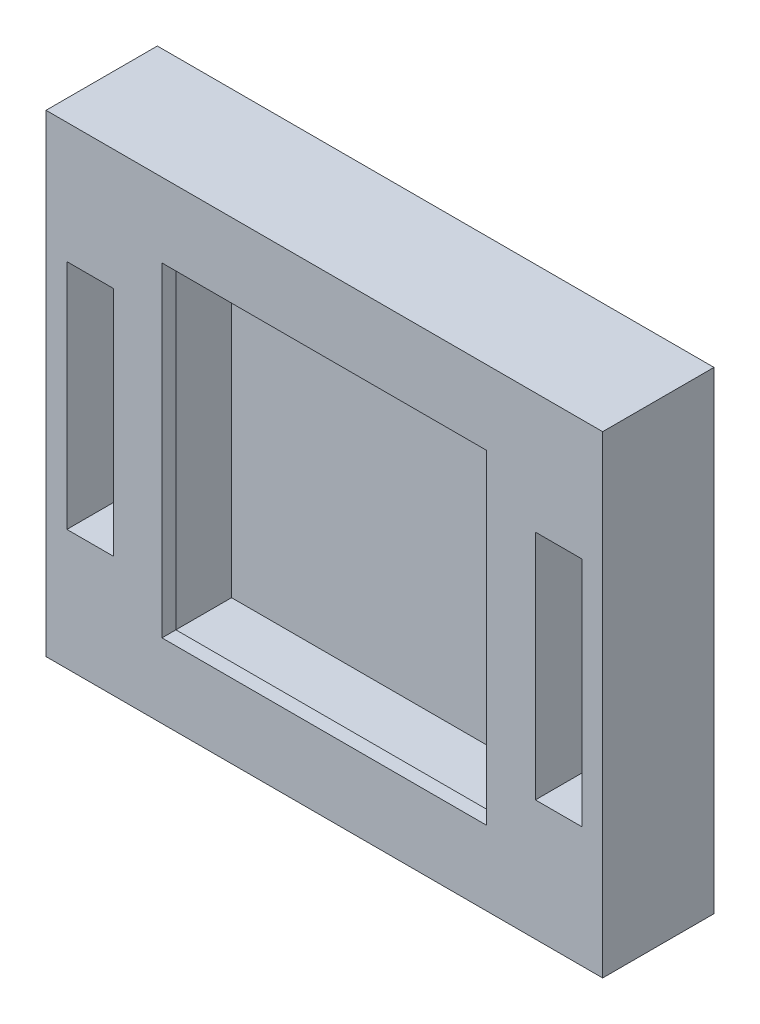
from build123d import *

# Parameters (mm, degrees)
SKETCH1_W           = 30.48
SKETCH1_H           = 25.908
BOSS_EXTRUDE1_DEPTH = 5.334
SKETCH2_W           = 20.828
SKETCH2_H           = 20.828
CUT_EXTRUDE1_DEPTH  = 4.572
SKETCH3_W           = 30.48
SKETCH3_H           = 25.908
SKETCH3_W_2         = 17.78
SKETCH3_H_2         = 17.78
BOSS_EXTRUDE2_DEPTH = 0.762
SKETCH4_W           = 2.54
SKETCH4_H           = 12.7
CUT_EXTRUDE5_DEPTH  = 21.909924247


with BuildPart() as part:
    # Sketch1 → Boss-Extrude1 (new body)
    with BuildSketch(Plane.XY):
        Rectangle(SKETCH1_W, SKETCH1_H)
    extrude(amount=BOSS_EXTRUDE1_DEPTH)

    # Sketch2 → Cut-Extrude1 (cut)
    with BuildSketch(Plane.XY.offset(5.334)):
        Rectangle(SKETCH2_W, SKETCH2_H)
    extrude(amount=-CUT_EXTRUDE1_DEPTH, mode=Mode.SUBTRACT)

    # Sketch3 → Boss-Extrude2 (add)
    with BuildSketch(Plane.XY.offset(5.334)):
        Rectangle(SKETCH3_W, SKETCH3_H)
        Rectangle(SKETCH3_W_2, SKETCH3_H_2, mode=Mode.SUBTRACT)
    extrude(amount=BOSS_EXTRUDE2_DEPTH)

    # Sketch4 → Cut-Extrude5 (cut, through all)
    with BuildSketch(Plane.XY.offset(6.096)):
        with Locations((-12.827, 0)):
            Rectangle(SKETCH4_W, SKETCH4_H)
        with Locations((12.827, 0)):
            Rectangle(SKETCH4_W, SKETCH4_H)
    extrude(amount=-CUT_EXTRUDE5_DEPTH, mode=Mode.SUBTRACT)


solid = part.part
